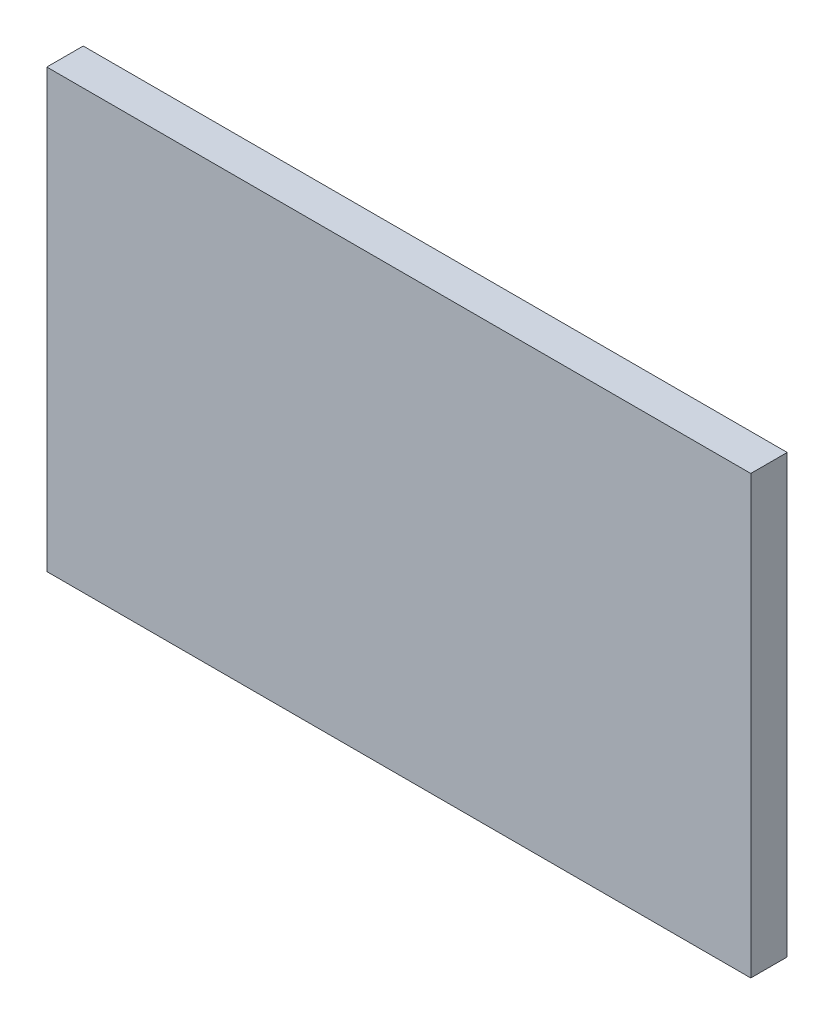
from build123d import *

# Parameters (mm, degrees)
SKETCH1_W           = 14.5
SKETCH1_H           = 0.75
BOSS_EXTRUDE1_DEPTH = 9


with BuildPart() as part:
    # Sketch1 → Boss-Extrude1 (new body)
    with BuildSketch(Plane(origin=(0, 0, 0), x_dir=(1, 0, 0), z_dir=(0, 1, 0))):
        with Locations((0.25, -0.125)):
            Rectangle(SKETCH1_W, SKETCH1_H)
    extrude(amount=BOSS_EXTRUDE1_DEPTH)


solid = part.part
